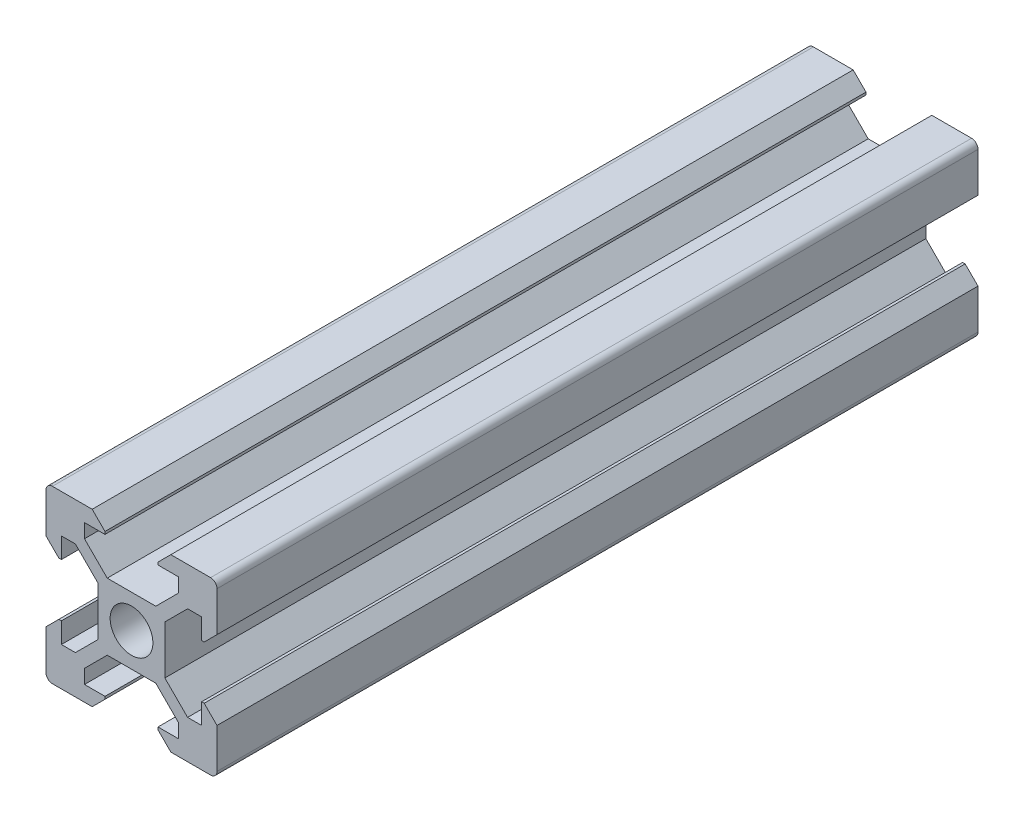
from build123d import *

# Parameters (mm, degrees)
CROQUIS1_R              = 2.5
SALIENTE_EXTRUIR1_DEPTH = 89


with BuildPart() as part:
    # Croquis1 → Saliente-Extruir1 (new body)
    with BuildSketch(Plane.XY):
        with BuildLine():
            Line((-4.6, 10), (-3.1, 8.5))
            Line((-3.1, 8.5), (-3.1, 8.2))
            Line((-3.1, 8.2), (-5.5, 8.2))
            Line((-5.5, 8.2), (-5.5, 6.560660172))
            Line((-5.5, 6.560660172), (-2.84, 3.900660172))
            Line((-2.84, 3.900660172), (0, 3.900660172))
            Line((0, 3.900660172), (2.84, 3.900660172))
            Line((2.84, 3.900660172), (5.5, 6.560660172))
            Line((5.5, 6.560660172), (5.5, 8.2))
            Line((5.5, 8.2), (3.1, 8.2))
            Line((3.1, 8.2), (3.1, 8.5))
            Line((3.1, 8.5), (4.6, 10))
            Line((4.6, 10), (9.25, 10))
            ThreePointArc((9.25, 10), (9.780330086, 9.780330086), (10, 9.25))
            Line((10, 9.25), (10, 4.6))
            Line((10, 4.6), (8.5, 3.1))
            Line((8.5, 3.1), (8.2, 3.1))
            Line((8.2, 3.1), (8.2, 5.5))
            Line((8.2, 5.5), (6.560660172, 5.5))
            Line((6.560660172, 5.5), (3.900660172, 2.84))
            Line((3.900660172, 2.84), (3.900660172, 0))
            Line((3.900660172, 0), (3.900660172, -2.84))
            Line((3.900660172, -2.84), (6.560660172, -5.5))
            Line((6.560660172, -5.5), (8.2, -5.5))
            Line((8.2, -5.5), (8.2, -3.1))
            Line((8.2, -3.1), (8.5, -3.1))
            Line((8.5, -3.1), (10, -4.6))
            Line((10, -4.6), (10, -9.25))
            ThreePointArc((10, -9.25), (9.780330086, -9.780330086), (9.25, -10))
            Line((9.25, -10), (4.6, -10))
            Line((4.6, -10), (3.1, -8.5))
            Line((3.1, -8.5), (3.1, -8.2))
            Line((3.1, -8.2), (5.5, -8.2))
            Line((5.5, -8.2), (5.5, -6.560660172))
            Line((5.5, -6.560660172), (2.84, -3.900660172))
            Line((2.84, -3.900660172), (0, -3.900660172))
            Line((0, -3.900660172), (-2.84, -3.900660172))
            Line((-2.84, -3.900660172), (-5.5, -6.560660172))
            Line((-5.5, -6.560660172), (-5.5, -8.2))
            Line((-5.5, -8.2), (-3.1, -8.2))
            Line((-3.1, -8.2), (-3.1, -8.5))
            Line((-3.1, -8.5), (-4.6, -10))
            Line((-4.6, -10), (-9.25, -10))
            ThreePointArc((-9.25, -10), (-9.780330086, -9.780330086), (-10, -9.25))
            Line((-10, -9.25), (-10, -4.6))
            Line((-10, -4.6), (-8.5, -3.1))
            Line((-8.5, -3.1), (-8.2, -3.1))
            Line((-8.2, -3.1), (-8.2, -5.5))
            Line((-8.2, -5.5), (-6.560660172, -5.5))
            Line((-6.560660172, -5.5), (-3.900660172, -2.84))
            Line((-3.900660172, -2.84), (-3.900660172, 0))
            Line((-3.900660172, 0), (-3.900660172, 2.84))
            Line((-3.900660172, 2.84), (-6.560660172, 5.5))
            Line((-6.560660172, 5.5), (-8.2, 5.5))
            Line((-8.2, 5.5), (-8.2, 3.1))
            Line((-8.2, 3.1), (-8.5, 3.1))
            Line((-8.5, 3.1), (-10, 4.6))
            Line((-10, 4.6), (-10, 9.25))
            ThreePointArc((-10, 9.25), (-9.780330086, 9.780330086), (-9.25, 10))
            Line((-9.25, 10), (-4.6, 10))
        make_face()
        Circle(CROQUIS1_R, mode=Mode.SUBTRACT)
    extrude(amount=SALIENTE_EXTRUIR1_DEPTH)


solid = part.part
